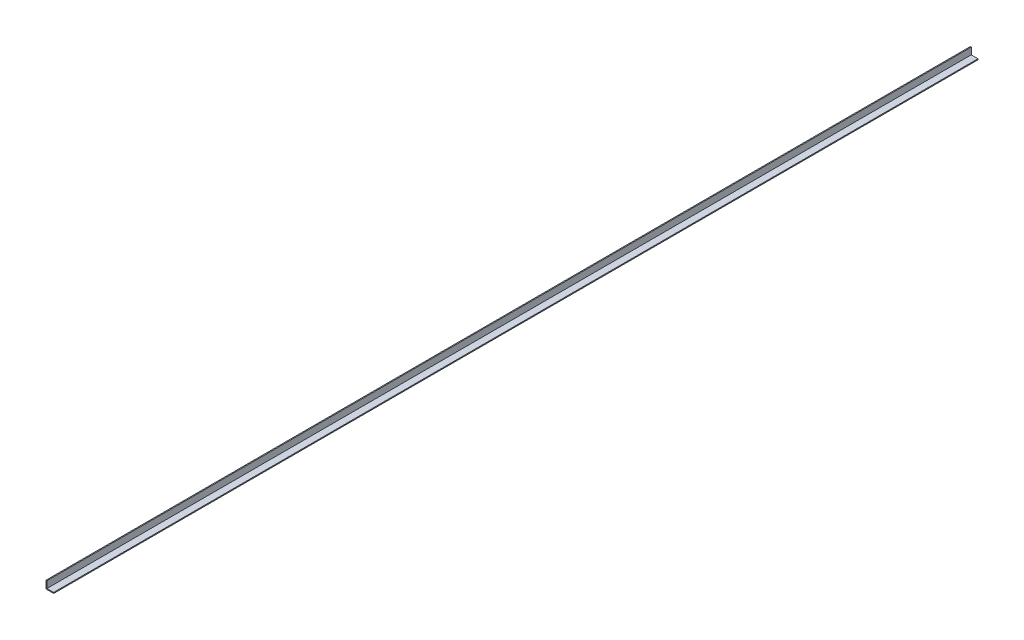
from build123d import *

# Parameters (mm, degrees)
SALIENTE_EXTRUIR1_DEPTH = 6100


with BuildPart() as part:
    # Croquis1 → Saliente-Extruir1 (new body)
    with BuildSketch(Plane.XY):
        Polygon((0, 50.8), (0, 0), (50.8, 0), (50.8, 6.35), (6.35, 6.35), (6.35, 50.8), align=None)
    extrude(amount=-SALIENTE_EXTRUIR1_DEPTH)


solid = part.part
